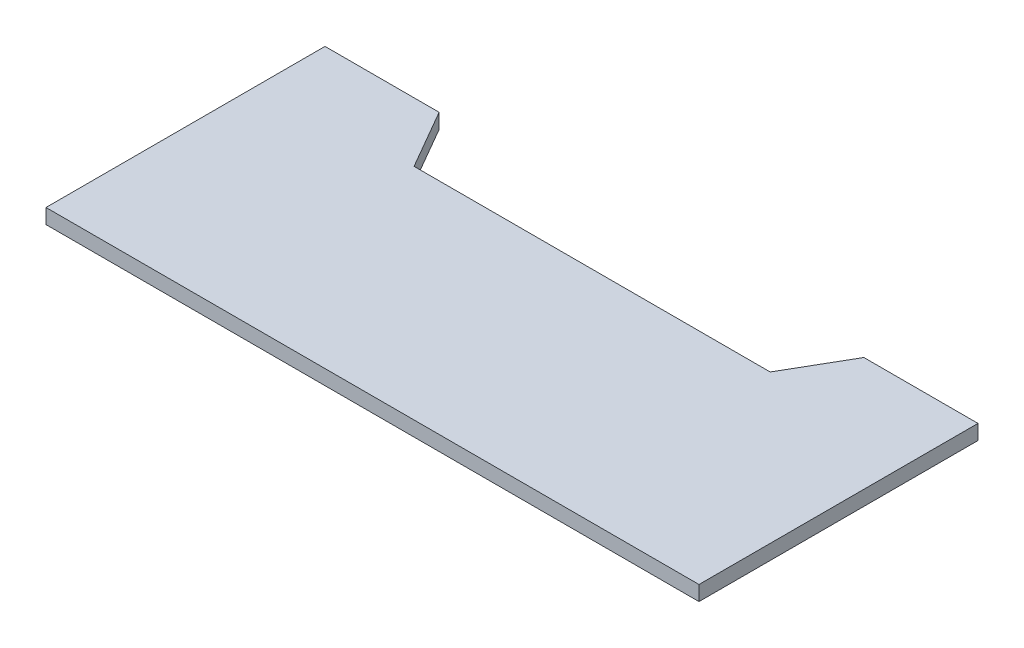
from build123d import *

# Parameters (mm, degrees)
SKETCH1_W           = 279.4
SKETCH1_H           = 119.38
BOSS_EXTRUDE1_DEPTH = 6.35
CUT_EXTRUDE1_DEPTH  = 304.901738889


with BuildPart() as part:
    # Sketch1 → Boss-Extrude1 (new body)
    with BuildSketch(Plane(origin=(0, 0, 0), x_dir=(1, 0, 0), z_dir=(0, 1, 0))):
        with Locations((139.7, 59.69)):
            Rectangle(SKETCH1_W, SKETCH1_H)
    extrude(amount=BOSS_EXTRUDE1_DEPTH)

    # Sketch2 → Cut-Extrude1 (cut, through all)
    with BuildSketch(Plane(origin=(0, 6.35, 0), x_dir=(1, 0, 0), z_dir=(0, 1, 0))):
        Polygon((48.835303163, 119.38), (63.5, 93.98), (215.9, 93.98), (230.564696837, 119.38), align=None)
    extrude(amount=-CUT_EXTRUDE1_DEPTH, mode=Mode.SUBTRACT)


solid = part.part
